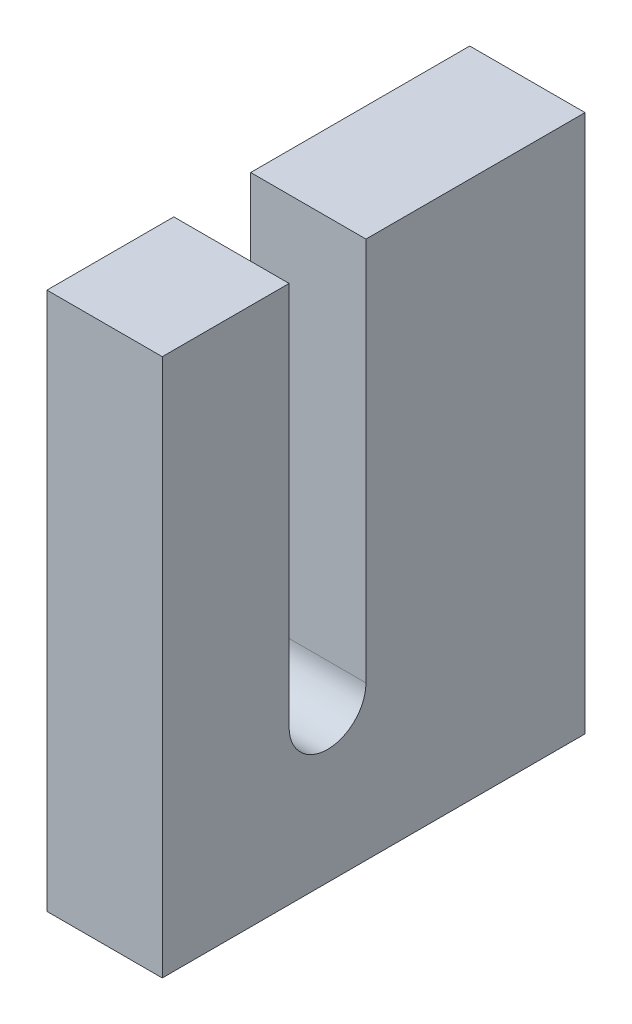
from build123d import *

# Parameters (mm, degrees)
ESQUISSE1_W             = 15
ESQUISSE1_H             = 55
BOSS_EXTRU_1_DEPTH      = 70
ENL_V_MAT_EXTRU_1_DEPTH = 45


with BuildPart() as part:
    # Esquisse1 → Boss.-Extru.1 (new body)
    with BuildSketch(Plane(origin=(0, 0, 0), x_dir=(1, 0, 0), z_dir=(0, 1, 0))):
        Rectangle(ESQUISSE1_W, ESQUISSE1_H)
    extrude(amount=BOSS_EXTRU_1_DEPTH)

    # Esquisse3 → Enlèv. mat.-Extru.1 (cut)
    with BuildSketch(Plane.ZY.offset(7.5)):
        with BuildLine():
            Line((11, 20), (11, 70))
            Line((11, 70), (1, 70))
            Line((1, 70), (1, 20))
            ThreePointArc((1, 20), (6, 15), (11, 20))
        make_face()
    extrude(amount=-ENL_V_MAT_EXTRU_1_DEPTH, mode=Mode.SUBTRACT)


solid = part.part
